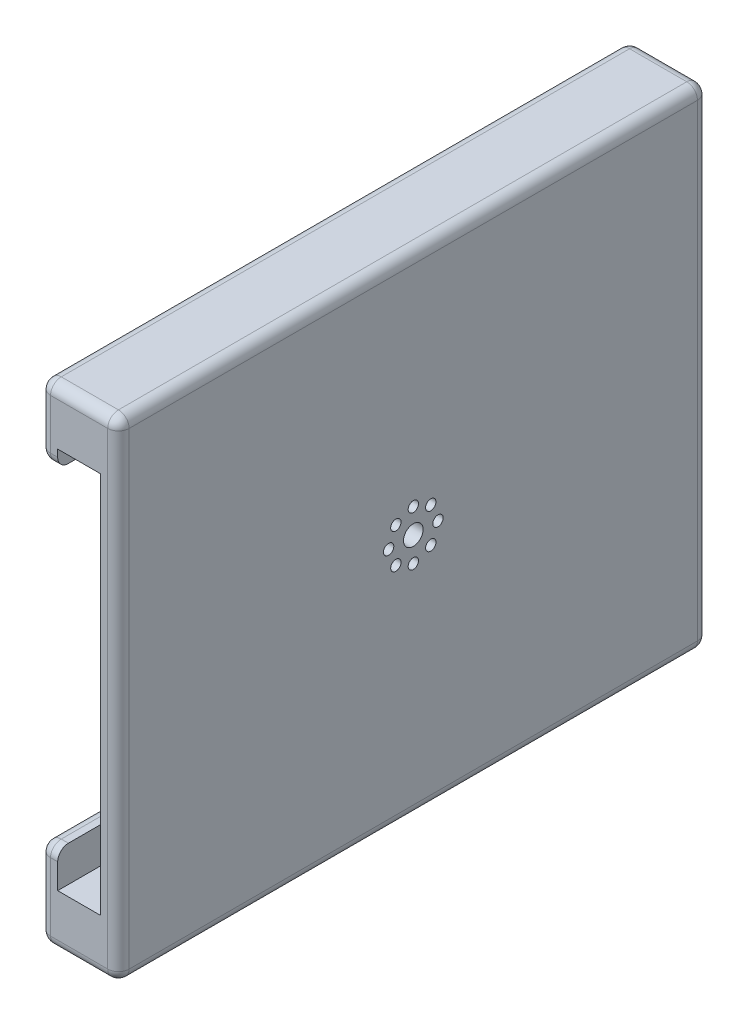
from build123d import *

# Parameters (mm, degrees)
SKETCH1_W           = 165
SKETCH1_H           = 137
BOSS_EXTRUDE1_DEPTH = 22
CUT_EXTRUDE1_DEPTH  = 165
FILLET1_R           = 3
SKETCH3_R           = 2.75
SKETCH3_R_2         = 1.45
CUT_EXTRUDE2_DEPTH  = 5
FILLET2_R           = 3
FILLET3_R           = 3


with BuildPart() as part:
    # Sketch1 → Boss-Extrude1 (new body)
    with BuildSketch(Plane(origin=(0, 0, 0), x_dir=(0, 0, -1), z_dir=(1, 0, 0))):
        Rectangle(SKETCH1_W, SKETCH1_H)
    extrude(amount=BOSS_EXTRUDE1_DEPTH)

    # Sketch2 → Cut-Extrude1 (cut)
    with BuildSketch(Plane.XY.offset(82.5)):
        Polygon((0, 48.5), (5, 48.5), (5, 53.5), (17, 53.5), (17, -53.5), (5, -53.5), (5, -43.5), (0, -43.5), align=None)
    extrude(amount=-CUT_EXTRUDE1_DEPTH, mode=Mode.SUBTRACT)

    # Fillet1
    fillet1_edges = [part.edges().sort_by_distance(p)[0] for p in [
        (22, -68.5, 0),
        (0, -43.5, 0),
        (0, 48.5, 0),
        (0, -68.5, 0),
        (0, 68.5, 0),
        (22, 68.5, 0),
    ]]
    fillet(fillet1_edges, radius=FILLET1_R)

    # Sketch3 → Cut-Extrude2 (cut)
    with BuildSketch(Plane.ZY.offset(-17)):
        with Locations(Location((0, -0.084265268, 0), (0, 0, 270))):
            Circle(SKETCH3_R)
        with Locations(Location((6.905, -0.084265268, 0), (0, 0, 270))):
            Circle(SKETCH3_R_2)
        with Locations(Location((4.882572324, -4.966837592, 0), (0, 0, 270))):
            Circle(SKETCH3_R_2)
        with Locations(Location((0, -6.989265268, 0), (0, 0, 270))):
            Circle(SKETCH3_R_2)
        with Locations(Location((-4.882572324, -4.966837592, 0), (0, 0, 270))):
            Circle(SKETCH3_R_2)
        with Locations(Location((-6.905, -0.084265268, 0), (0, 0, 270))):
            Circle(SKETCH3_R_2)
        with Locations(Location((-4.882572324, 4.798307056, 0), (0, 0, 270))):
            Circle(SKETCH3_R_2)
        with Locations(Location((0, 6.820734732, 0), (0, 0, 270))):
            Circle(SKETCH3_R_2)
        with Locations(Location((4.882572324, 4.798307056, 0), (0, 0, 270))):
            Circle(SKETCH3_R_2)
    extrude(amount=-CUT_EXTRUDE2_DEPTH, mode=Mode.SUBTRACT)

    # Fillet2
    fillet2_edges = [part.edges().sort_by_distance(p)[0] for p in [
        (4, 48.5, -82.5),
        (22, 0, -82.5),
        (0, 58.5, -82.5),
        (11, 68.5, -82.5),
        (11, -68.5, -82.5),
        (0, -56, -82.5),
        (4, -43.5, -82.5),
        (0.878679656, -44.378679656, -82.5),
        (0.878679656, 49.378679656, -82.5),
        (0.878679656, 67.621320344, -82.5),
        (21.121320344, 67.621320344, -82.5),
        (0.878679656, -67.621320344, -82.5),
        (21.121320344, -67.621320344, -82.5),
    ]]
    fillet(fillet2_edges, radius=FILLET2_R)

    # Fillet3
    fillet3_edges = [part.edges().sort_by_distance(p)[0] for p in [
        (4, 48.5, 82.5),
        (22, 0, 82.5),
        (11, -68.5, 82.5),
        (0, 58.5, 82.5),
        (4, -43.5, 82.5),
        (0, -56, 82.5),
        (11, 68.5, 82.5),
        (0.878679656, -44.378679656, 82.5),
        (0.878679656, 49.378679656, 82.5),
        (0.878679656, 67.621320344, 82.5),
        (21.121320344, 67.621320344, 82.5),
        (0.878679656, -67.621320344, 82.5),
        (21.121320344, -67.621320344, 82.5),
    ]]
    fillet(fillet3_edges, radius=FILLET3_R)


solid = part.part
